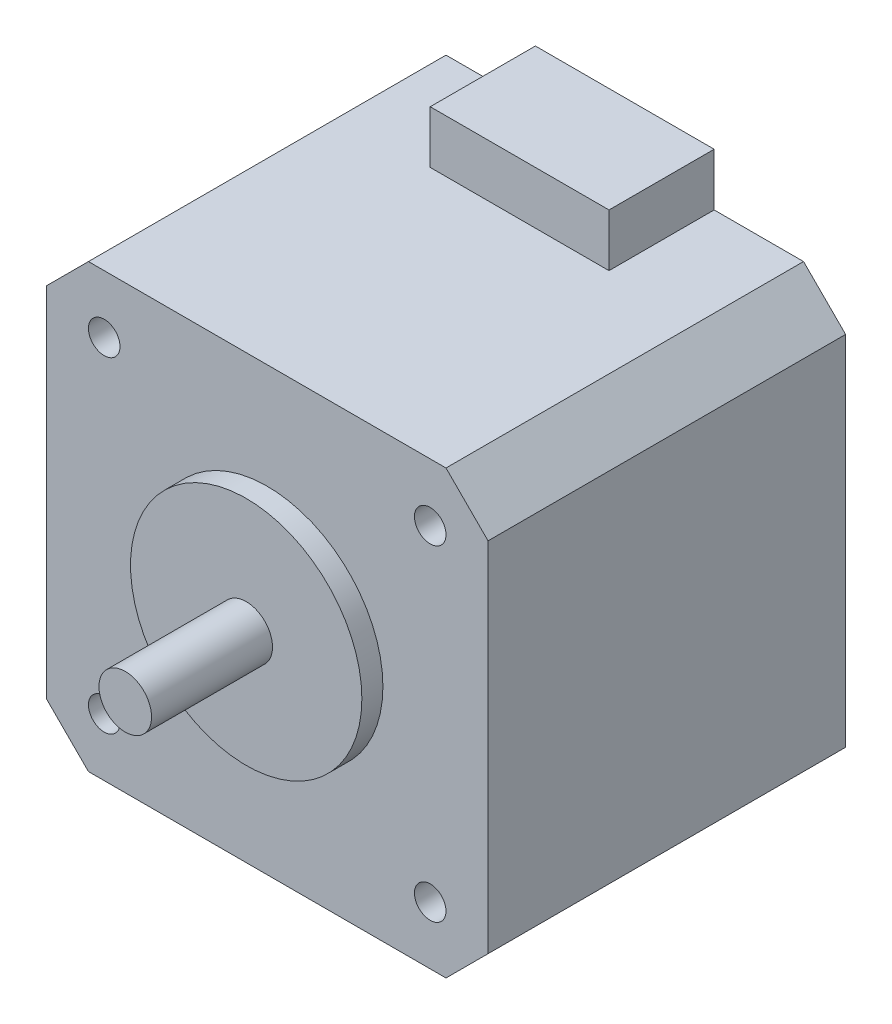
from build123d import *

# Parameters (mm, degrees)
ESQUISSE1_W             = 42
ESQUISSE1_H             = 42
BOSS_EXTRU_1_DEPTH      = 34
ESQUISSE2_R             = 11
BOSS_EXTRU_2_DEPTH      = 2
ESQUISSE3_R             = 2.5
BOSS_EXTRU_3_DEPTH      = 11.5
CHANFREIN1_SIZE         = 4
ESQUISSE4_W             = 17
ESQUISSE4_H             = 10
BOSS_EXTRU_4_DEPTH      = 5
ESQUISSE5_R             = 1.5
ENL_V_MAT_EXTRU_1_DEPTH = 5


with BuildPart() as part:
    # Esquisse1 → Boss.-Extru.1 (new body)
    with BuildSketch(Plane.XY):
        with Locations((21, 21)):
            Rectangle(ESQUISSE1_W, ESQUISSE1_H)
    extrude(amount=BOSS_EXTRU_1_DEPTH)

    # Esquisse2 → Boss.-Extru.2 (add)
    with BuildSketch(Plane.XY.offset(34)):
        with Locations((21, 21)):
            Circle(ESQUISSE2_R)
    extrude(amount=BOSS_EXTRU_2_DEPTH)

    # Esquisse3 → Boss.-Extru.3 (add)
    with BuildSketch(Plane.XY.offset(36)):
        with Locations((21, 21)):
            Circle(ESQUISSE3_R)
    extrude(amount=BOSS_EXTRU_3_DEPTH)

    # Chanfrein1
    chanfrein1_edges = [part.edges().sort_by_distance(p)[0] for p in [
        (0, 42, 17),
        (42, 42, 17),
        (42, 0, 17),
        (0, 0, 17),
    ]]
    chamfer(chanfrein1_edges, length=CHANFREIN1_SIZE)

    # Esquisse4 → Boss.-Extru.4 (add)
    with BuildSketch(Plane(origin=(0, 42, 0), x_dir=(1, 0, 0), z_dir=(0, 1, 0))):
        with Locations((21, -5)):
            Rectangle(ESQUISSE4_W, ESQUISSE4_H)
    extrude(amount=BOSS_EXTRU_4_DEPTH)

    # Esquisse5 → Enlèv. mat.-Extru.1 (cut)
    with BuildSketch(Plane.XY.offset(34)):
        with Locations((5.5, 36.5)):
            Circle(ESQUISSE5_R)
        with Locations((36.5, 36.5)):
            Circle(ESQUISSE5_R)
        with Locations((36.5, 5.5)):
            Circle(ESQUISSE5_R)
        with Locations((5.5, 5.5)):
            Circle(ESQUISSE5_R)
    extrude(amount=-ENL_V_MAT_EXTRU_1_DEPTH, mode=Mode.SUBTRACT)


solid = part.part
